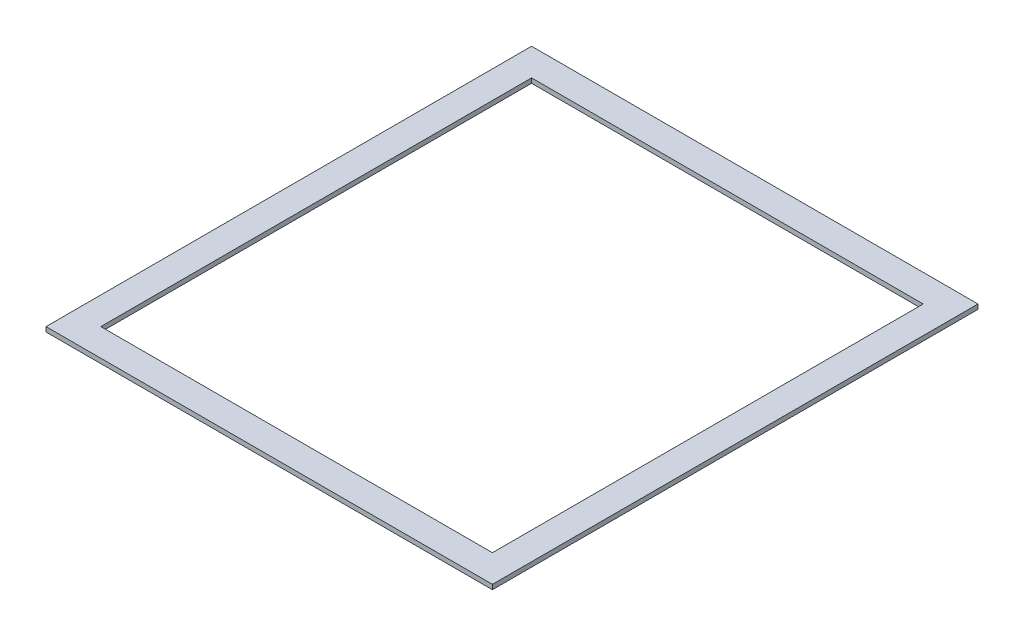
from build123d import *

# Parameters (mm, degrees)
SKETCH1_W           = 57
SKETCH1_H           = 62
SKETCH1_W_2         = 50
SKETCH1_H_2         = 55
BOSS_EXTRUDE1_DEPTH = 0.6


with BuildPart() as part:
    # Sketch1 → Boss-Extrude1 (new body)
    with BuildSketch(Plane(origin=(0, 0, 0), x_dir=(1, 0, 0), z_dir=(0, 1, 0))):
        Rectangle(SKETCH1_W, SKETCH1_H)
        Rectangle(SKETCH1_W_2, SKETCH1_H_2, mode=Mode.SUBTRACT)
    extrude(amount=BOSS_EXTRUDE1_DEPTH)


solid = part.part
